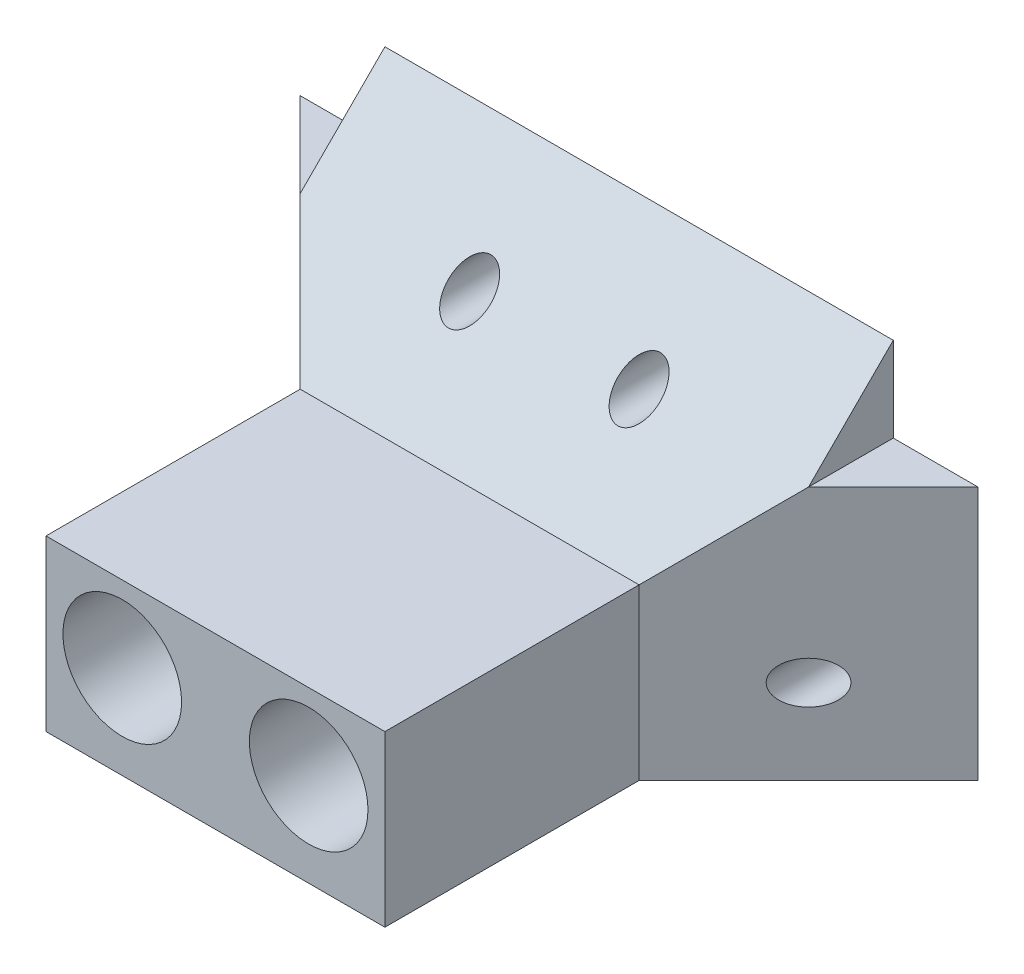
from build123d import *

# Parameters (mm, degrees)
SKETCH_1_W                = 20
SKETCH_1_H                = 20
EXTRUDE_1_DEPTH           = 40
SKETCH_2_W                = 10
SKETCH_2_H                = 15
CUT_EXTRUDE_1_DEPTH       = 7.071067812
PATTERN_CIRCULAR_1_COUNT  = 4
SKETCH_5_R                = 3.5
CUT_EXTRUDE_2_DEPTH       = 25
CUT_EXTRUDE_3_DEPTH       = 5
SKETCH_9_W                = 5.878932188
SKETCH_9_H                = 5.878932188
CUT_EXTRUDE_5_DEPTH       = 5
SKETCH_11_W               = 10
SKETCH_11_H               = 30
EXTRUDE_2_DEPTH           = 10
CUT_EXTRUDE_6_DEPTH       = 30
SKETCH_13_R               = 1.25
CUT_EXTRUDE_7_DEPTH       = 10
PATTERN_CIRCULAR_2_COUNT  = 4
SKETCH_16_W               = 20
SKETCH_16_H               = 10
CUT_EXTRUDE_11_DEPTH      = 40
SKETCH_17_W               = 20
SKETCH_17_H               = 20
SKETCH_17_W_2             = 5.857864376
SKETCH_17_H_2             = 5.857864376
CUT_EXTRUDE_12_DEPTH      = 5
CUT_EXTRUDE_13_DEPTH      = 54.851648071
CUT_EXTRUDE_13_DEPTH_BACK = 10
SKETCH_19_W               = 81.536041923
SKETCH_19_H               = 68.786769913
CUT_EXTRUDE_16_DEPTH      = 400


with BuildPart() as part:
    # 스케치1 → 보스-돌출1 (new body)
    with BuildSketch(Plane.XY):
        Rectangle(SKETCH_1_W, SKETCH_1_H)
    extrude(amount=EXTRUDE_1_DEPTH)

    # 스케치2 → 컷-돌출1 (cut)
    with BuildSketch(Plane(origin=(10, 0, 0), x_dir=(0, 0, -1), z_dir=(1, 0, 0))):
        with Locations((-10, 0)):
            Rectangle(SKETCH_2_W, SKETCH_2_H)
    cut_extrude_1 = extrude(amount=-CUT_EXTRUDE_1_DEPTH, mode=Mode.SUBTRACT)

    # 원형 패턴1: 컷-돌출1 ×4 about axis
    pattern_circular_1_axis = Axis((0, 0, 0), (0, 0, 1))
    for i in range(1, PATTERN_CIRCULAR_1_COUNT):
        add(cut_extrude_1.rotate(pattern_circular_1_axis, i * 360 / PATTERN_CIRCULAR_1_COUNT), mode=Mode.SUBTRACT)

    # 스케치5 → 컷-돌출2 (cut)
    with BuildSketch(Plane.XY.offset(40)):
        with Locations((-5.5, 5.5)):
            Circle(SKETCH_5_R)
        with Locations((5.5, 5.5)):
            Circle(SKETCH_5_R)
        with Locations(Location((-5.5, -5.5, 0), (0, 0, 235.150095421))):
            Circle(SKETCH_5_R)
        with Locations(Location((5.5, -5.5, 0), (0, 0, 304.849904579))):
            Circle(SKETCH_5_R)
    extrude(amount=-CUT_EXTRUDE_2_DEPTH, mode=Mode.SUBTRACT)

    # 스케치6 → 컷-돌출3 (cut)
    with BuildSketch(Plane(origin=(0, 0, 0), x_dir=(-1, 0, 0), z_dir=(0, 0, -1))):
        Polygon((-14.808802863, -2.95), (-14.808802863, 2.95), (-2.95, 2.95), (-2.95, 12.360254216), (2.95, 12.360254216), (2.95, 2.95), (13.852115441, 2.95), (13.852115441, -2.95), (2.95, -2.95), (2.95, -13.975695818), (-2.95, -13.975695818), (-2.95, -2.95), align=None)
    extrude(amount=-CUT_EXTRUDE_3_DEPTH, mode=Mode.SUBTRACT)

    # 스케치9 → 컷-돌출5 (cut)
    with BuildSketch(Plane(origin=(0, 0, 5), x_dir=(-1, 0, 0), z_dir=(0, 0, -1))):
        with Locations((0.010533906, -0.010533906)):
            Rectangle(SKETCH_9_W, SKETCH_9_H)
    extrude(amount=-CUT_EXTRUDE_5_DEPTH, mode=Mode.SUBTRACT)

    # 스케치11 → 보스-돌출2 (add)
    with BuildSketch(Plane(origin=(10, 0, 0), x_dir=(0, 0, -1), z_dir=(1, 0, 0))):
        with Locations((-20, 0)):
            Rectangle(SKETCH_11_W, SKETCH_11_H)
    extrude_2 = extrude(amount=EXTRUDE_2_DEPTH)

    # 스케치12 → 컷-돌출6 (cut)
    with BuildSketch(Plane(origin=(0, 15, 0), x_dir=(1, 0, 0), z_dir=(0, 1, 0))):
        Polygon((20, -15), (10, -25), (20, -25), align=None)
    cut_extrude_6 = extrude(amount=-CUT_EXTRUDE_6_DEPTH, mode=Mode.SUBTRACT)

    # 스케치13 → 컷-돌출7 (cut)
    with BuildSketch(Plane(origin=(0, 0, 15), x_dir=(-1, 0, 0), z_dir=(0, 0, -1))):
        with Locations(Location((-15, -5, 0), (0, 0, 90))):
            Circle(SKETCH_13_R)
        with Locations(Location((-15, 5, 0), (0, 0, 90))):
            Circle(SKETCH_13_R)
    cut_extrude_7 = extrude(amount=-CUT_EXTRUDE_7_DEPTH, mode=Mode.SUBTRACT)

    # 원형 패턴2: 보스-돌출2, 컷-돌출6, 컷-돌출7 ×4 about axis
    pattern_circular_2_axis = Axis((0, 0, 0), (0, 0, 1))
    add([extrude_2.rotate(pattern_circular_2_axis, i * 360 / PATTERN_CIRCULAR_2_COUNT) for i in range(1, PATTERN_CIRCULAR_2_COUNT)])
    add([cut_extrude_6.rotate(pattern_circular_2_axis, i * 360 / PATTERN_CIRCULAR_2_COUNT) for i in range(1, PATTERN_CIRCULAR_2_COUNT)], mode=Mode.SUBTRACT)
    add([cut_extrude_7.rotate(pattern_circular_2_axis, i * 360 / PATTERN_CIRCULAR_2_COUNT) for i in range(1, PATTERN_CIRCULAR_2_COUNT)], mode=Mode.SUBTRACT)

    # 스케치16 → 컷-돌출11 (cut)
    with BuildSketch(Plane.XZ.offset(10)):
        with Locations((0, 5)):
            Rectangle(SKETCH_16_W, SKETCH_16_H)
    extrude(amount=-CUT_EXTRUDE_11_DEPTH, mode=Mode.SUBTRACT)

    # 스케치17 → 컷-돌출12 (cut)
    with BuildSketch(Plane(origin=(0, 0, 10), x_dir=(-1, 0, 0), z_dir=(0, 0, -1))):
        Rectangle(SKETCH_17_W, SKETCH_17_H)
        Rectangle(SKETCH_17_W_2, SKETCH_17_H_2, mode=Mode.SUBTRACT)
    extrude(amount=-CUT_EXTRUDE_12_DEPTH, mode=Mode.SUBTRACT)

    # 스케치18 → 컷-돌출13 (cut, two sides: drawn at the far end of the back side and taken through both)
    with BuildSketch(Plane.XZ.offset(-10).offset(-CUT_EXTRUDE_13_DEPTH_BACK)):
        Polygon((10, 25), (15, 25), (15, 20), align=None)
    extrude(amount=CUT_EXTRUDE_13_DEPTH + CUT_EXTRUDE_13_DEPTH_BACK, mode=Mode.SUBTRACT)

    # 스케치19 → 컷-돌출16 (cut)
    with BuildSketch(Plane(origin=(0, 0, 0), x_dir=(1, 0, 0), z_dir=(0, 1, 0))):
        with Locations((9.636077682, -26.334226141)):
            Rectangle(SKETCH_19_W, SKETCH_19_H)
    extrude(amount=-CUT_EXTRUDE_16_DEPTH, mode=Mode.SUBTRACT)


solid = part.part
